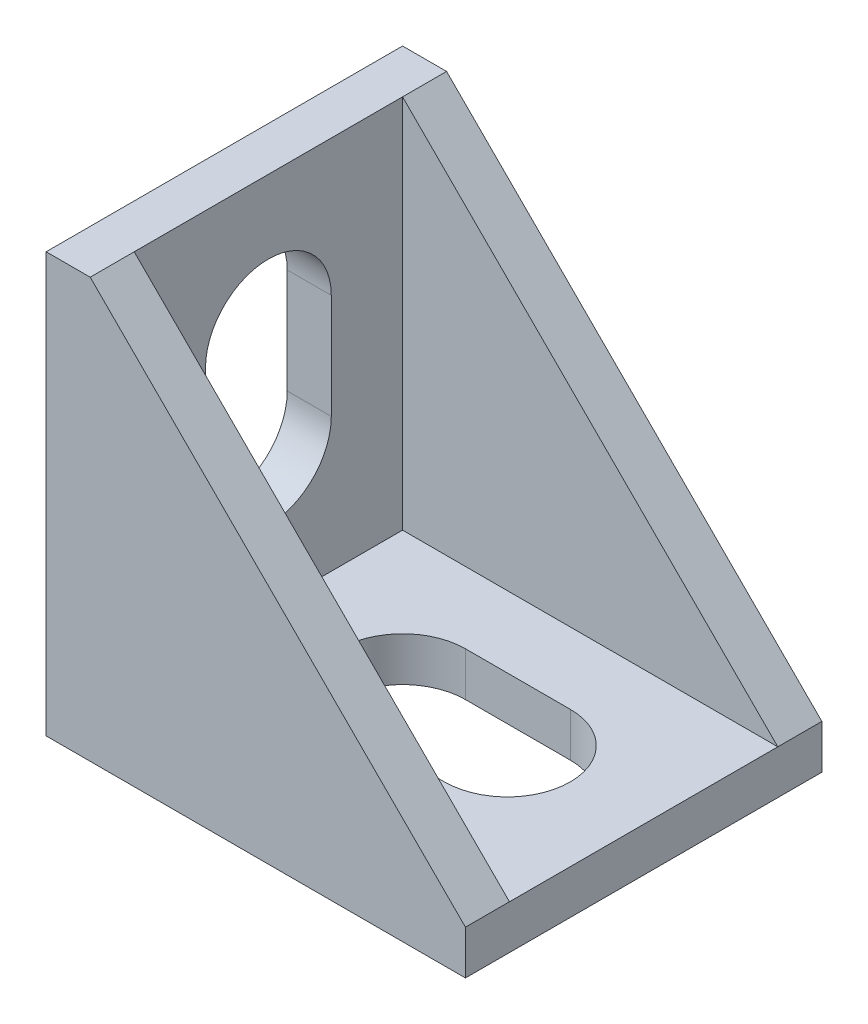
from build123d import *

# Parameters (mm, degrees)
EXTRUDE_1_DEPTH     = 17
EXTRUDE_2_DEPTH     = 2.1
EXTRUDE_3_DEPTH     = 2.1
CUT_EXTRUDE_1_DEPTH = 32.771213386
CUT_EXTRUDE_2_DEPTH = 32.771213386


with BuildPart() as part:
    # 草图1 → 凸台-拉伸1 (new body)
    with BuildSketch(Plane.XY):
        Polygon((0, 0), (20, 0), (20, 2.1), (2.1, 2.1), (2.1, 20), (0, 20), align=None)
    extrude(amount=EXTRUDE_1_DEPTH)

    # 草图2 → 凸台-拉伸2 (add)
    with BuildSketch(Plane(origin=(0, 0, 0), x_dir=(-1, 0, 0), z_dir=(0, 0, -1))):
        Polygon((-2.1, 20), (-2.1, 2.1), (-20, 2.1), align=None)
    extrude(amount=-EXTRUDE_2_DEPTH)

    # 草图3 → 凸台-拉伸3 (add)
    with BuildSketch(Plane.XY.offset(17)):
        Polygon((2.1, 20), (2.1, 2.1), (20, 2.1), align=None)
    extrude(amount=-EXTRUDE_3_DEPTH)

    # 草图4 → 切除-拉伸1 (cut, through all)
    with BuildSketch(Plane(origin=(2.1, 0, 0), x_dir=(0, 0, -1), z_dir=(1, 0, 0))):
        with BuildLine():
            Line((-11.5, 13.5), (-11.5, 8.5))
            ThreePointArc((-11.5, 8.5), (-8.5, 5.5), (-5.5, 8.5))
            Line((-5.5, 8.5), (-5.5, 13.5))
            ThreePointArc((-5.5, 13.5), (-8.5, 16.5), (-11.5, 13.5))
        make_face()
    extrude(amount=-CUT_EXTRUDE_1_DEPTH, mode=Mode.SUBTRACT)

    # 草图5 → 切除-拉伸2 (cut, through all)
    with BuildSketch(Plane(origin=(0, 2.1, 0), x_dir=(1, 0, 0), z_dir=(0, 1, 0))):
        with BuildLine():
            Line((8.5, -11.5), (13.5, -11.5))
            ThreePointArc((13.5, -11.5), (16.5, -8.5), (13.5, -5.5))
            Line((13.5, -5.5), (8.5, -5.5))
            ThreePointArc((8.5, -5.5), (5.5, -8.5), (8.5, -11.5))
        make_face()
    extrude(amount=-CUT_EXTRUDE_2_DEPTH, mode=Mode.SUBTRACT)


solid = part.part
